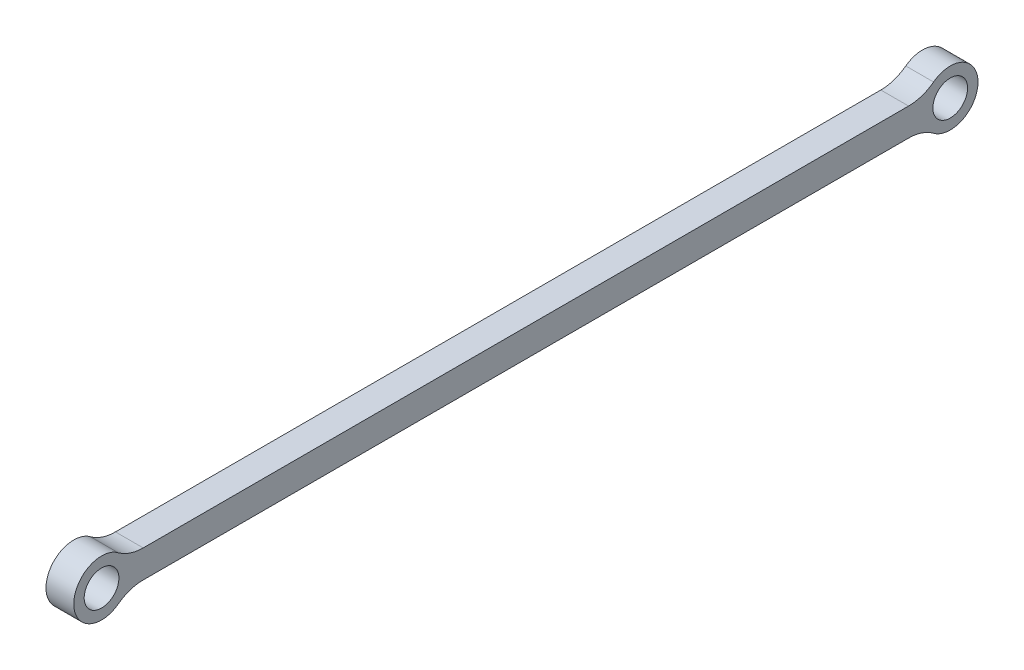
from build123d import *
from build123d.topology import SkipClean

# Parameters (mm, degrees)
SKETCH_1_R          = 5
EXTRUDE_1_DEPTH     = 8
CUT_EXTRUDE_1_DEPTH = 253.753338257
FILLET_1_R          = 12


with BuildPart() as part:
    # 草图1 → 凸台-拉伸1 (new body)
    with BuildSketch(Plane(origin=(0, 0, 0), x_dir=(0, 0, -1), z_dir=(1, 0, 0))):
        with BuildLine():
            Line((0, 8), (244.5, 8))
            ThreePointArc((244.5, 8), (252.5, 0), (244.5, -8))
            Line((244.5, -8), (0, -8))
            ThreePointArc((0, -8), (-8, 0), (0, 8))
        make_face()
        with Locations((244.5, 0)):
            Circle(SKETCH_1_R, mode=Mode.SUBTRACT)
        Circle(SKETCH_1_R, mode=Mode.SUBTRACT)
    extrude(amount=EXTRUDE_1_DEPTH)

    # 草图2 → 切除-拉伸1 (cut, through all)
    with SkipClean():  # the faces are left unmerged after this step: merging them gives an invalid solid
        with BuildSketch(Plane(origin=(8, 0, 0), x_dir=(0, 0, -1), z_dir=(1, 0, 0))):
            with BuildLine():
                Line((237.57179677, -4), (6.92820323, -4))
                ThreePointArc((6.92820323, -4), (4, -6.92820323), (0, -8))
                Line((0, -8), (244.5, -8))
                ThreePointArc((244.5, -8), (240.5, -6.92820323), (237.57179677, -4))
            make_face()
            with BuildLine():
                Line((237.57179677, 4), (6.92820323, 4))
                ThreePointArc((6.92820323, 4), (4, 6.92820323), (0, 8))
                Line((0, 8), (244.5, 8))
                ThreePointArc((244.5, 8), (240.5, 6.92820323), (237.57179677, 4))
            make_face()
        extrude(amount=-CUT_EXTRUDE_1_DEPTH, mode=Mode.SUBTRACT)

    # 圆角1
    fillet_1_edges = [part.edges().sort_by_distance(p)[0] for p in [
        (4, -4, -6.92820323),
        (4, -4, -237.57179677),
        (4, 4, -237.57179677),
        (4, 4, -6.92820323),
    ]]
    fillet(fillet_1_edges, radius=FILLET_1_R)


with BuildPart() as part_1:
    # Move Body 5: moved
    add(part.part.moved(Location((0, 0, 244.5))))


with BuildPart() as part_2:
    # Move Body 3: moved
    add(part_1.part.moved(Location((0, 0, -244.5))))


solid = part_2.part
